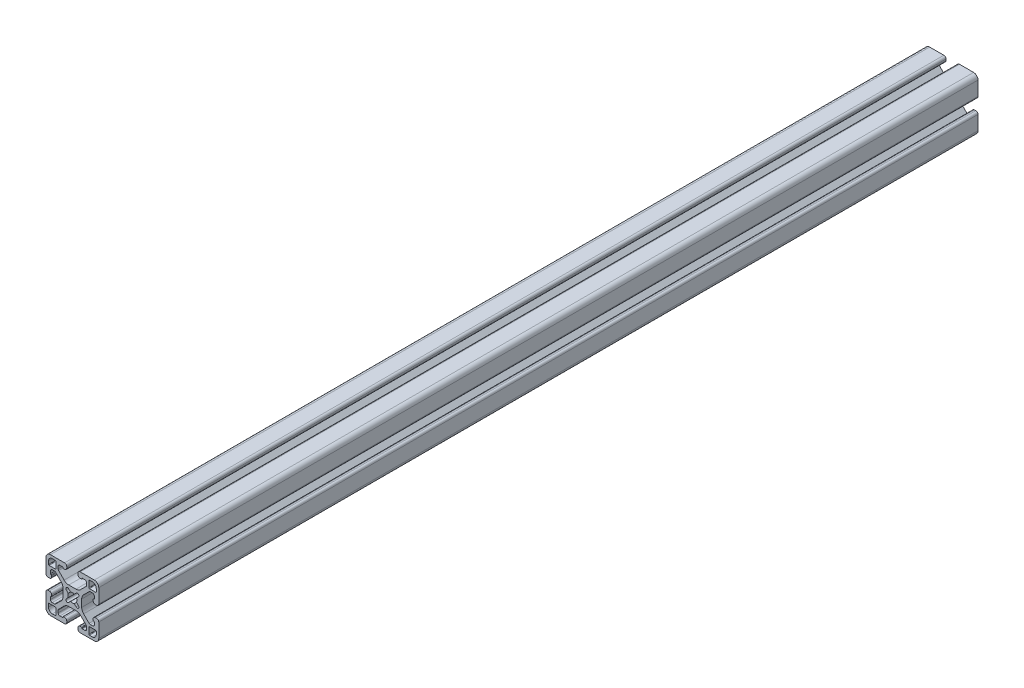
from build123d import *

# Parameters (mm, degrees)
EXTRUDE1_DEPTH = 635


with BuildPart() as part:
    # Sketch1 → Extrude1 (new body)
    with BuildSketch(Plane.XY):
        with BuildLine():
            Line((-46.536752228, -7.000622168), (-46.536752228, -8.774580164))
            ThreePointArc((-46.536752228, -8.774580164), (-46.907290083, -9.675221514), (-47.806745776, -10.048628264))
            Line((-47.806745776, -10.048628264), (-49.392633083, -10.048628264))
            ThreePointArc((-49.392633083, -10.048628264), (-49.878641042, -9.95195527), (-50.290658695, -9.676653876))
            Line((-50.290658695, -9.676653876), (-54.238761565, -5.728551005))
            ThreePointArc((-54.238761565, -5.728551005), (-55.26838878, -4.187604983), (-55.629945776, -2.369935216))
            Line((-55.629945776, -2.369935216), (-55.629945776, 2.846678689))
            ThreePointArc((-55.629945776, 2.846678689), (-55.26838878, 4.664348456), (-54.238761565, 6.205294478))
            Line((-54.238761565, 6.205294478), (-50.290658695, 10.153397348))
            ThreePointArc((-50.290658695, 10.153397348), (-49.878641042, 10.428698742), (-49.392633083, 10.525371736))
            Line((-49.392633083, 10.525371736), (-47.806745776, 10.525371736))
            ThreePointArc((-47.806745776, 10.525371736), (-46.907290079, 10.151964982), (-46.536752228, 9.251323623))
            Line((-46.536752228, 9.251323623), (-46.536752228, 7.47736564))
            ThreePointArc((-46.536752228, 7.47736564), (-46.648344767, 7.207957418), (-46.91775299, 7.096364878))
            Line((-46.91775299, 7.096364878), (-46.993953142, 7.096364878))
            ThreePointArc((-46.993953142, 7.096364878), (-47.263362671, 6.984771032), (-47.374953904, 6.715360422))
            Line((-47.374953904, 6.715360422), (-47.374945776, 5.877156465))
            ThreePointArc((-47.374945776, 5.877156465), (-46.913692136, 4.763614578), (-45.800145776, 4.302371736))
            Line((-45.800145776, 4.302371736), (-44.885745776, 4.302371736))
            ThreePointArc((-44.885745776, 4.302371736), (-43.772194017, 4.763619977), (-43.310945776, 5.877171736))
            Line((-43.310945776, 5.877171736), (-43.310945776, 16.113371736))
            ThreePointArc((-43.310945776, 16.113371736), (-44.240881746, 18.358435766), (-46.485945776, 19.288371736))
            Line((-46.485945776, 19.288371736), (-56.722145776, 19.288371736))
            ThreePointArc((-56.722145776, 19.288371736), (-57.835697535, 18.827123495), (-58.296945776, 17.713571736))
            Line((-58.296945776, 17.713571736), (-58.296945776, 16.799171736))
            ThreePointArc((-58.296945776, 16.799171736), (-57.835702934, 15.685625376), (-56.722161047, 15.224371736))
            Line((-56.722161047, 15.224371736), (-55.883957091, 15.224363608))
            ThreePointArc((-55.883957091, 15.224363608), (-55.61454648, 15.335954841), (-55.502952634, 15.60536437))
            Line((-55.502952634, 15.60536437), (-55.502952634, 15.681564523))
            ThreePointArc((-55.502952634, 15.681564523), (-55.391360095, 15.950972745), (-55.121951872, 16.062565285))
            Line((-55.121951872, 16.062565285), (-53.347993876, 16.062565285))
            ThreePointArc((-53.347993876, 16.062565285), (-52.447352526, 15.692027429), (-52.073945776, 14.792571736))
            Line((-52.073945776, 14.792571736), (-52.073945776, 13.206684429))
            ThreePointArc((-52.073945776, 13.206684429), (-52.17061877, 12.72067647), (-52.445920164, 12.308658817))
            Line((-52.445920164, 12.308658817), (-56.394023034, 8.360555947))
            ThreePointArc((-56.394023034, 8.360555947), (-57.934969057, 7.330928733), (-59.752638824, 6.969371736))
            Line((-59.752638824, 6.969371736), (-64.969252728, 6.969371736))
            ThreePointArc((-64.969252728, 6.969371736), (-66.786922495, 7.330928733), (-68.327868518, 8.360555947))
            Line((-68.327868518, 8.360555947), (-72.275971388, 12.308658817))
            ThreePointArc((-72.275971388, 12.308658817), (-72.551272782, 12.72067647), (-72.647945776, 13.206684429))
            Line((-72.647945776, 13.206684429), (-72.647945776, 14.792571736))
            ThreePointArc((-72.647945776, 14.792571736), (-72.274539022, 15.692027434), (-71.373897663, 16.062565285))
            Line((-71.373897663, 16.062565285), (-69.59993968, 16.062565285))
            ThreePointArc((-69.59993968, 16.062565285), (-69.330531458, 15.950972745), (-69.218938918, 15.681564523))
            Line((-69.218938918, 15.681564523), (-69.218938918, 15.60536437))
            ThreePointArc((-69.218938918, 15.60536437), (-69.107345072, 15.335954841), (-68.837934461, 15.224363608))
            Line((-68.837934461, 15.224363608), (-67.999730505, 15.224371736))
            ThreePointArc((-67.999730505, 15.224371736), (-66.886188618, 15.685625376), (-66.424945776, 16.799171736))
            Line((-66.424945776, 16.799171736), (-66.424945776, 17.713571736))
            ThreePointArc((-66.424945776, 17.713571736), (-66.886194017, 18.827123495), (-67.999745776, 19.288371736))
            Line((-67.999745776, 19.288371736), (-78.235945776, 19.288371736))
            ThreePointArc((-78.235945776, 19.288371736), (-80.481009806, 18.358435766), (-81.410945776, 16.113371736))
            Line((-81.410945776, 16.113371736), (-81.410945776, 5.877171736))
            ThreePointArc((-81.410945776, 5.877171736), (-80.949697535, 4.763619977), (-79.836145776, 4.302371736))
            Line((-79.836145776, 4.302371736), (-78.921745776, 4.302371736))
            ThreePointArc((-78.921745776, 4.302371736), (-77.808199416, 4.763614578), (-77.346945776, 5.877156465))
            Line((-77.346945776, 5.877156465), (-77.346937648, 6.715360422))
            ThreePointArc((-77.346937648, 6.715360422), (-77.458528881, 6.984771032), (-77.72793841, 7.096364878))
            Line((-77.72793841, 7.096364878), (-77.804138562, 7.096364878))
            ThreePointArc((-77.804138562, 7.096364878), (-78.073546785, 7.207957418), (-78.185139324, 7.47736564))
            Line((-78.185139324, 7.47736564), (-78.185139324, 9.251323637))
            ThreePointArc((-78.185139324, 9.251323637), (-77.814601469, 10.151964987), (-76.915145776, 10.525371736))
            Line((-76.915145776, 10.525371736), (-75.329258469, 10.525371736))
            ThreePointArc((-75.329258469, 10.525371736), (-74.84325051, 10.428698742), (-74.431232857, 10.153397348))
            Line((-74.431232857, 10.153397348), (-70.483129987, 6.205294478))
            ThreePointArc((-70.483129987, 6.205294478), (-69.453502773, 4.664348456), (-69.091945776, 2.846678689))
            Line((-69.091945776, 2.846678689), (-69.091945776, -2.369935216))
            ThreePointArc((-69.091945776, -2.369935216), (-69.453502773, -4.187604983), (-70.483129987, -5.728551005))
            Line((-70.483129987, -5.728551005), (-74.431232857, -9.676653876))
            ThreePointArc((-74.431232857, -9.676653876), (-74.84325051, -9.95195527), (-75.329258469, -10.048628264))
            Line((-75.329258469, -10.048628264), (-76.915145776, -10.048628264))
            ThreePointArc((-76.915145776, -10.048628264), (-77.814601473, -9.67522151), (-78.185139324, -8.774580151))
            Line((-78.185139324, -8.774580151), (-78.185139324, -7.000622168))
            ThreePointArc((-78.185139324, -7.000622168), (-78.073546785, -6.731213945), (-77.804138562, -6.619621406))
            Line((-77.804138562, -6.619621406), (-77.72793841, -6.619621406))
            ThreePointArc((-77.72793841, -6.619621406), (-77.458528881, -6.50802756), (-77.346937648, -6.238616949))
            Line((-77.346937648, -6.238616949), (-77.346945776, -5.400412993))
            ThreePointArc((-77.346945776, -5.400412993), (-77.808199416, -4.286871106), (-78.921745776, -3.825628264))
            Line((-78.921745776, -3.825628264), (-79.836145776, -3.825628264))
            ThreePointArc((-79.836145776, -3.825628264), (-80.949697535, -4.286876505), (-81.410945776, -5.400428264))
            Line((-81.410945776, -5.400428264), (-81.410945776, -15.636628264))
            ThreePointArc((-81.410945776, -15.636628264), (-80.481009806, -17.881692294), (-78.235945776, -18.811628264))
            Line((-78.235945776, -18.811628264), (-67.999745776, -18.811628264))
            ThreePointArc((-67.999745776, -18.811628264), (-66.886194017, -18.350380023), (-66.424945776, -17.236828264))
            Line((-66.424945776, -17.236828264), (-66.424945776, -16.322428264))
            ThreePointArc((-66.424945776, -16.322428264), (-66.886188618, -15.208881904), (-67.999730505, -14.747628264))
            Line((-67.999730505, -14.747628264), (-68.837934461, -14.747620136))
            ThreePointArc((-68.837934461, -14.747620136), (-69.107345072, -14.859211369), (-69.218938918, -15.128620898))
            Line((-69.218938918, -15.128620898), (-69.218938918, -15.20482105))
            ThreePointArc((-69.218938918, -15.20482105), (-69.330531458, -15.474229273), (-69.59993968, -15.585821812))
            Line((-69.59993968, -15.585821812), (-71.373897676, -15.585821812))
            ThreePointArc((-71.373897676, -15.585821812), (-72.274539027, -15.215283957), (-72.647945776, -14.315828264))
            Line((-72.647945776, -14.315828264), (-72.647945776, -12.729940957))
            ThreePointArc((-72.647945776, -12.729940957), (-72.551272782, -12.243932998), (-72.275971388, -11.831915345))
            Line((-72.275971388, -11.831915345), (-68.327868518, -7.883812475))
            ThreePointArc((-68.327868518, -7.883812475), (-66.786922495, -6.85418526), (-64.969252728, -6.492628264))
            Line((-64.969252728, -6.492628264), (-59.752638824, -6.492628264))
            ThreePointArc((-59.752638824, -6.492628264), (-57.934969057, -6.85418526), (-56.394023034, -7.883812475))
            Line((-56.394023034, -7.883812475), (-52.445920164, -11.831915345))
            ThreePointArc((-52.445920164, -11.831915345), (-52.17061877, -12.243932998), (-52.073945776, -12.729940957))
            Line((-52.073945776, -12.729940957), (-52.073945776, -14.315828264))
            ThreePointArc((-52.073945776, -14.315828264), (-52.44735253, -15.215283961), (-53.347993889, -15.585821812))
            Line((-53.347993889, -15.585821812), (-55.121951872, -15.585821812))
            ThreePointArc((-55.121951872, -15.585821812), (-55.391360095, -15.474229273), (-55.502952634, -15.20482105))
            Line((-55.502952634, -15.20482105), (-55.502952634, -15.128620898))
            ThreePointArc((-55.502952634, -15.128620898), (-55.61454648, -14.859211369), (-55.883957091, -14.747620136))
            Line((-55.883957091, -14.747620136), (-56.722161047, -14.747628264))
            ThreePointArc((-56.722161047, -14.747628264), (-57.835702934, -15.208881904), (-58.296945776, -16.322428264))
            Line((-58.296945776, -16.322428264), (-58.296945776, -17.236828264))
            ThreePointArc((-58.296945776, -17.236828264), (-57.835697535, -18.350380023), (-56.722145776, -18.811628264))
            Line((-56.722145776, -18.811628264), (-46.485945776, -18.811628264))
            ThreePointArc((-46.485945776, -18.811628264), (-44.240881746, -17.881692294), (-43.310945776, -15.636628264))
            Line((-43.310945776, -15.636628264), (-43.310945776, -5.400428264))
            ThreePointArc((-43.310945776, -5.400428264), (-43.772194017, -4.286876505), (-44.885745776, -3.825628264))
            Line((-44.885745776, -3.825628264), (-45.800145776, -3.825628264))
            ThreePointArc((-45.800145776, -3.825628264), (-46.913692136, -4.286871106), (-47.374945776, -5.400412993))
            Line((-47.374945776, -5.400412993), (-47.374953904, -6.238616949))
            ThreePointArc((-47.374953904, -6.238616949), (-47.263362671, -6.50802756), (-46.993953142, -6.619621406))
            Line((-46.993953142, -6.619621406), (-46.91775299, -6.619621406))
            ThreePointArc((-46.91775299, -6.619621406), (-46.648344767, -6.731213945), (-46.536752228, -7.000622168))
        make_face()
        with BuildLine():
            Line((-66.704246649, -2.488483035), (-65.333825803, -1.118062189))
            ThreePointArc((-65.333825803, -1.118062189), (-65.628655776, 0.238371736), (-65.333825803, 1.594805661))
            Line((-65.333825803, 1.594805661), (-66.704246649, 2.965226507))
            ThreePointArc((-66.704246649, 2.965226507), (-66.704246649, 4.581672609), (-65.087800547, 4.581672609))
            Line((-65.087800547, 4.581672609), (-63.717379701, 3.211251763))
            ThreePointArc((-63.717379701, 3.211251763), (-62.360945776, 3.506081736), (-61.004511851, 3.211251763))
            Line((-61.004511851, 3.211251763), (-59.721184579, 4.483982556))
            ThreePointArc((-59.721184579, 4.483982556), (-58.017644903, 4.581672609), (-58.115334956, 2.878132934))
            Line((-58.115334956, 2.878132934), (-59.38806575, 1.594805661))
            ThreePointArc((-59.38806575, 1.594805661), (-59.093235776, 0.238371736), (-59.38806575, -1.118062189))
            Line((-59.38806575, -1.118062189), (-58.017644903, -2.488483035))
            ThreePointArc((-58.017644903, -2.488483035), (-58.017644903, -4.104929137), (-59.634091005, -4.104929137))
            Line((-59.634091005, -4.104929137), (-61.004511851, -2.73450829))
            ThreePointArc((-61.004511851, -2.73450829), (-62.360945776, -3.029338264), (-63.717379701, -2.73450829))
            Line((-63.717379701, -2.73450829), (-65.087800547, -4.104929137))
            ThreePointArc((-65.087800547, -4.104929137), (-66.704246649, -4.104929137), (-66.704246649, -2.488483035))
        make_face(mode=Mode.SUBTRACT)
        with BuildLine():
            Line((-79.607545776, 12.481171736), (-79.607545776, 14.690971736))
            ThreePointArc((-79.607545776, 14.690971736), (-78.789202123, 16.666628083), (-76.813545776, 17.484971736))
            Line((-76.813545776, 17.484971736), (-74.603745776, 17.484971736))
            ThreePointArc((-74.603745776, 17.484971736), (-74.334338092, 17.37337942), (-74.222745776, 17.103971736))
            Line((-74.222745776, 17.103971736), (-74.222745776, 12.481171736))
            ThreePointArc((-74.222745776, 12.481171736), (-74.334338092, 12.211764053), (-74.603745776, 12.100171736))
            Line((-74.603745776, 12.100171736), (-79.226545776, 12.100171736))
            ThreePointArc((-79.226545776, 12.100171736), (-79.49595346, 12.211764053), (-79.607545776, 12.481171736))
        make_face(mode=Mode.SUBTRACT)
        with BuildLine():
            Line((-74.603745776, -17.008228264), (-76.813545776, -17.008228264))
            ThreePointArc((-76.813545776, -17.008228264), (-78.789202123, -16.18988461), (-79.607545776, -14.214228264))
            Line((-79.607545776, -14.214228264), (-79.607545776, -12.004428264))
            ThreePointArc((-79.607545776, -12.004428264), (-79.49595346, -11.73502058), (-79.226545776, -11.623428264))
            Line((-79.226545776, -11.623428264), (-74.603745776, -11.623428264))
            ThreePointArc((-74.603745776, -11.623428264), (-74.334338092, -11.73502058), (-74.222745776, -12.004428264))
            Line((-74.222745776, -12.004428264), (-74.222745776, -16.627228264))
            ThreePointArc((-74.222745776, -16.627228264), (-74.334338092, -16.896635947), (-74.603745776, -17.008228264))
        make_face(mode=Mode.SUBTRACT)
        with BuildLine():
            Line((-45.114345776, -12.004428264), (-45.114345776, -14.214228264))
            ThreePointArc((-45.114345776, -14.214228264), (-45.932689429, -16.18988461), (-47.908345776, -17.008228264))
            Line((-47.908345776, -17.008228264), (-50.118145776, -17.008228264))
            ThreePointArc((-50.118145776, -17.008228264), (-50.38755346, -16.896635947), (-50.499145776, -16.627228264))
            Line((-50.499145776, -16.627228264), (-50.499145776, -12.004428264))
            ThreePointArc((-50.499145776, -12.004428264), (-50.38755346, -11.73502058), (-50.118145776, -11.623428264))
            Line((-50.118145776, -11.623428264), (-45.495345776, -11.623428264))
            ThreePointArc((-45.495345776, -11.623428264), (-45.225938092, -11.73502058), (-45.114345776, -12.004428264))
        make_face(mode=Mode.SUBTRACT)
        with BuildLine():
            Line((-50.118145776, 17.484971736), (-47.908345776, 17.484971736))
            ThreePointArc((-47.908345776, 17.484971736), (-45.932689429, 16.666628083), (-45.114345776, 14.690971736))
            Line((-45.114345776, 14.690971736), (-45.114345776, 12.481171736))
            ThreePointArc((-45.114345776, 12.481171736), (-45.225938092, 12.211764053), (-45.495345776, 12.100171736))
            Line((-45.495345776, 12.100171736), (-50.118145776, 12.100171736))
            ThreePointArc((-50.118145776, 12.100171736), (-50.38755346, 12.211764053), (-50.499145776, 12.481171736))
            Line((-50.499145776, 12.481171736), (-50.499145776, 17.103971736))
            ThreePointArc((-50.499145776, 17.103971736), (-50.38755346, 17.37337942), (-50.118145776, 17.484971736))
        make_face(mode=Mode.SUBTRACT)
    extrude(amount=-EXTRUDE1_DEPTH)


solid = part.part
